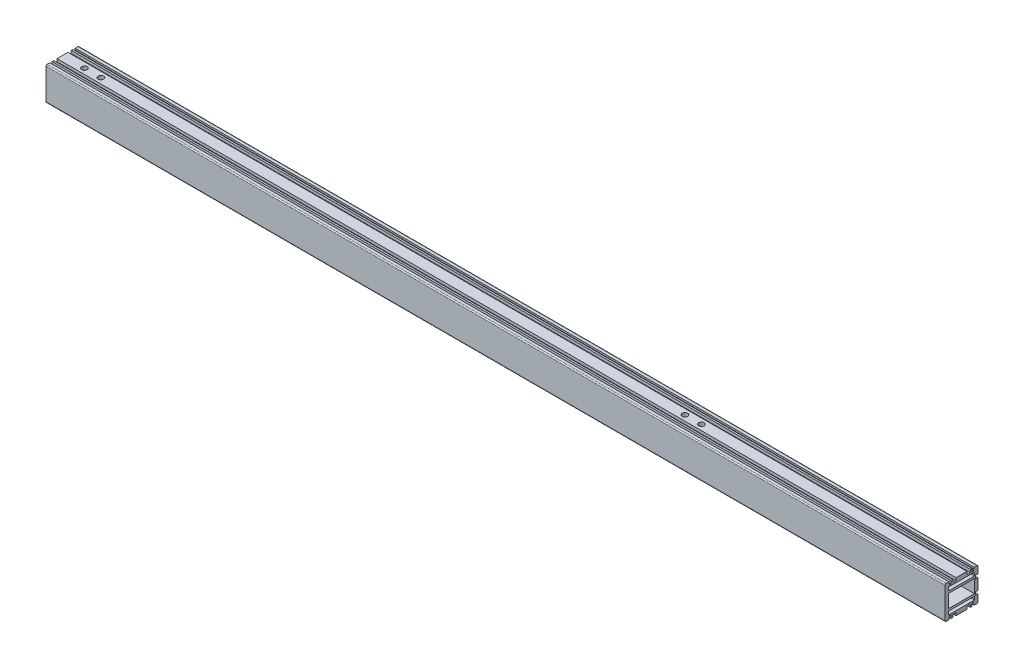
from build123d import *

# Parameters (mm, degrees)
SKETCH_1_W             = 23.5
SKETCH_1_H             = 12
EXTRUDE_1_DEPTH        = 409.5
HOLE_WIZARD_M6_1_D     = 5
HOLE_WIZARD_M6_1_DEPTH = 15
HOLE_WIZARD_M6_1_TIP   = 1.502151548
HOLE_WIZARD_M6_2_D     = 5
HOLE_WIZARD_M6_2_DEPTH = 15
HOLE_WIZARD_M6_2_TIP   = 1.502151548
HOLE_WIZARD_M6_3_D     = 5
HOLE_WIZARD_M6_3_DEPTH = 15
HOLE_WIZARD_M6_3_TIP   = 1.502151548


with BuildPart() as part:
    # 草图1 → 凸台-拉伸1 (new, symmetric)
    with BuildSketch(Plane(origin=(0, 0, 0), x_dir=(0, 0, -1), z_dir=(1, 0, 0))):
        with BuildLine():
            Line((-14, 15), (-11.5, 15))
            Line((-11.5, 15), (-11.5, 13.5))
            Line((-11.5, 13.5), (-11.4, 13.5))
            ThreePointArc((-11.4, 13.5), (-11.117157288, 13.382842712), (-11, 13.1))
            Line((-11, 13.1), (-11, 12))
            Line((-11, 12), (-9.5, 12))
            Line((-9.5, 12), (-9.5, 15))
            Line((-9.5, 15), (-8, 15))
            Line((-8, 15), (-8, 12.5))
            Line((-8, 12.5), (-5, 12.5))
            Line((-5, 12.5), (-5, 15))
            Line((-5, 15), (5, 15))
            Line((5, 15), (5, 12.5))
            Line((5, 12.5), (8, 12.5))
            Line((8, 12.5), (8, 15))
            Line((8, 15), (9.5, 15))
            Line((9.5, 15), (9.5, 12))
            Line((9.5, 12), (11, 12))
            Line((11, 12), (11, 13.1))
            ThreePointArc((11, 13.1), (11.117157288, 13.382842712), (11.4, 13.5))
            Line((11.4, 13.5), (11.5, 13.5))
            Line((11.5, 13.5), (11.5, 15))
            Line((11.5, 15), (14, 15))
            ThreePointArc((14, 15), (14.707106781, 14.707106781), (15, 14))
            Line((15, 14), (15, 8))
            Line((15, 8), (12.5, 8))
            Line((12.5, 8), (12.5, 5))
            Line((12.5, 5), (15, 5))
            Line((15, 5), (15, -5))
            Line((15, -5), (12.5, -5))
            Line((12.5, -5), (12.5, -8))
            Line((12.5, -8), (15, -8))
            Line((15, -8), (15, -14))
            ThreePointArc((15, -14), (14.707106781, -14.707106781), (14, -15))
            Line((14, -15), (11.5, -15))
            Line((11.5, -15), (11.5, -13.5))
            Line((11.5, -13.5), (11.4, -13.5))
            ThreePointArc((11.4, -13.5), (11.117157288, -13.382842712), (11, -13.1))
            Line((11, -13.1), (11, -12))
            Line((11, -12), (9.5, -12))
            Line((9.5, -12), (9.5, -15))
            Line((9.5, -15), (8, -15))
            Line((8, -15), (8, -12.5))
            Line((8, -12.5), (5, -12.5))
            Line((5, -12.5), (5, -15))
            Line((5, -15), (-5, -15))
            Line((-5, -15), (-5, -12.5))
            Line((-5, -12.5), (-8, -12.5))
            Line((-8, -12.5), (-8, -15))
            Line((-8, -15), (-9.5, -15))
            Line((-9.5, -15), (-9.5, -12))
            Line((-9.5, -12), (-11, -12))
            Line((-11, -12), (-11, -13.1))
            ThreePointArc((-11, -13.1), (-11.117157288, -13.382842712), (-11.4, -13.5))
            Line((-11.4, -13.5), (-11.5, -13.5))
            Line((-11.5, -13.5), (-11.5, -15))
            Line((-11.5, -15), (-14, -15))
            ThreePointArc((-14, -15), (-14.707106781, -14.707106781), (-15, -14))
            Line((-15, -14), (-15, 14))
            ThreePointArc((-15, 14), (-14.707106781, 14.707106781), (-14, 15))
        make_face()
        with BuildLine():
            Line((12, -10.5), (12, -8.5))
            ThreePointArc((12, -8.5), (11.853553391, -8.146446609), (11.5, -8))
            Line((11.5, -8), (-11.5, -8))
            ThreePointArc((-11.5, -8), (-11.853553391, -8.146446609), (-12, -8.5))
            Line((-12, -8.5), (-12, -10.5))
            ThreePointArc((-12, -10.5), (-11.853553391, -10.853553391), (-11.5, -11))
            Line((-11.5, -11), (11.5, -11))
            ThreePointArc((11.5, -11), (11.853553391, -10.853553391), (12, -10.5))
        make_face(mode=Mode.SUBTRACT)
        with BuildLine():
            Line((-11.5, 11), (11.5, 11))
            ThreePointArc((11.5, 11), (11.853553391, 10.853553391), (12, 10.5))
            Line((12, 10.5), (12, 8.5))
            ThreePointArc((12, 8.5), (11.853553391, 8.146446609), (11.5, 8))
            Line((11.5, 8), (-11.5, 8))
            ThreePointArc((-11.5, 8), (-11.853553391, 8.146446609), (-12, 8.5))
            Line((-12, 8.5), (-12, 10.5))
            ThreePointArc((-12, 10.5), (-11.853553391, 10.853553391), (-11.5, 11))
        make_face(mode=Mode.SUBTRACT)
        Rectangle(SKETCH_1_W, SKETCH_1_H, mode=Mode.SUBTRACT)
    extrude(amount=EXTRUDE_1_DEPTH, both=True)

    # M6 螺纹孔1
    with Locations(Plane.XZ.offset(15)):
        with Locations((-389.5, 0), (-374.5, 0), (192.5, 0), (207.5, 0), (277.5, 0), (292.5, 0), (374.5, 0), (389.5, 0)):
            Hole(HOLE_WIZARD_M6_1_D / 2, depth=HOLE_WIZARD_M6_1_DEPTH)
            with Locations((0, 0, -(HOLE_WIZARD_M6_1_DEPTH + HOLE_WIZARD_M6_1_TIP / 2))):  # 118° drill point
                Cone(0, HOLE_WIZARD_M6_1_D / 2, HOLE_WIZARD_M6_1_TIP, mode=Mode.SUBTRACT)

    # M6 螺纹孔2
    with Locations(Plane(origin=(0, 15, 0), x_dir=(-1, 0, 0), z_dir=(0, 1, 0))):
        with Locations((389.5, 0), (374.5, 0), (-157.5, 0), (-172.5, 0)):
            Hole(HOLE_WIZARD_M6_2_D / 2, depth=HOLE_WIZARD_M6_2_DEPTH)
            with Locations((0, 0, -(HOLE_WIZARD_M6_2_DEPTH + HOLE_WIZARD_M6_2_TIP / 2))):  # 118° drill point
                Cone(0, HOLE_WIZARD_M6_2_D / 2, HOLE_WIZARD_M6_2_TIP, mode=Mode.SUBTRACT)

    # M6 螺纹孔3
    with Locations(Plane(origin=(0, 0, -15), x_dir=(-1, 0, 0), z_dir=(0, 0, -1))):
        with Locations((-192.5, 0), (-207.5, 0), (-277.5, 0), (-292.5, 0), (-374.5, 0), (-389.5, 0)):
            Hole(HOLE_WIZARD_M6_3_D / 2, depth=HOLE_WIZARD_M6_3_DEPTH)
            with Locations((0, 0, -(HOLE_WIZARD_M6_3_DEPTH + HOLE_WIZARD_M6_3_TIP / 2))):  # 118° drill point
                Cone(0, HOLE_WIZARD_M6_3_D / 2, HOLE_WIZARD_M6_3_TIP, mode=Mode.SUBTRACT)


solid = part.part
